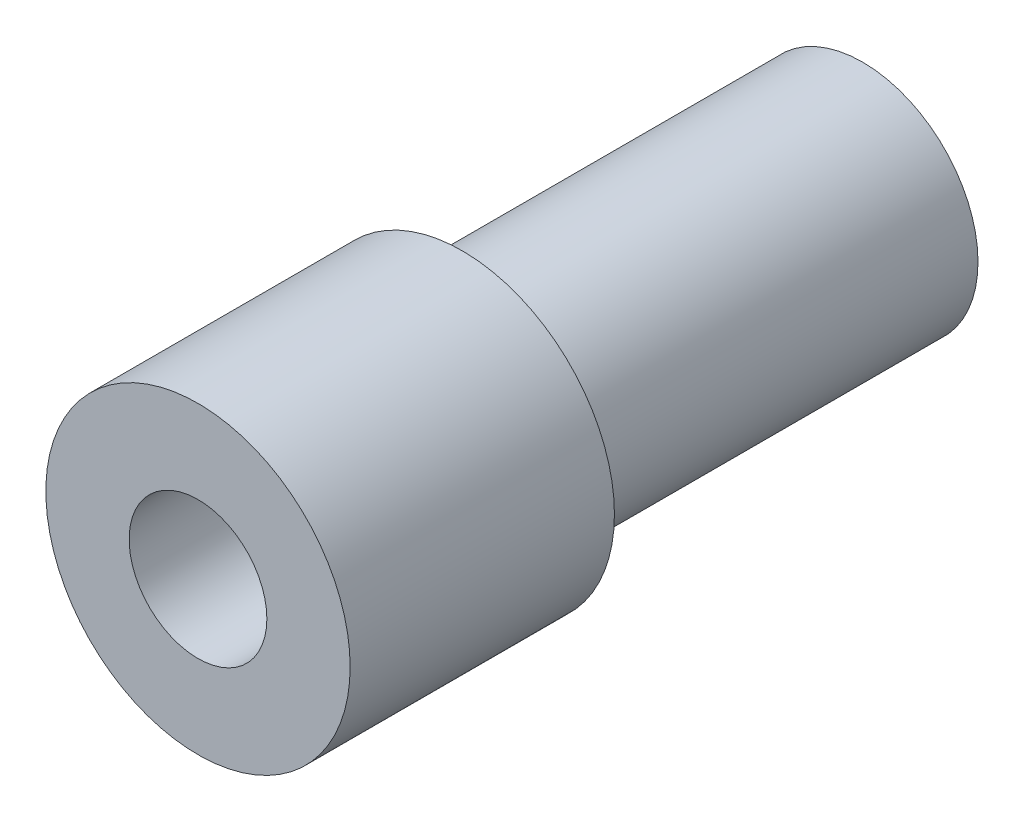
from build123d import *

# Parameters (mm, degrees)
SKETCH_1_R      = 14.4
SKETCH_1_R_2    = 8.6
EXTRUDE_1_DEPTH = 80
EXTRUDE_START   = 3
SKETCH_1_3_R    = 19
SKETCH_1_3_R_2  = 16
SKETCH_1_3_R_3  = 14.4
SKETCH_1_3_R_4  = 8.6
EXTRUDE_2_DEPTH = 3
SKETCH_1_5_R    = 19
SKETCH_1_5_R_2  = 16
EXTRUDE_3_DEPTH = 30
EXTRUDE_START_2 = -77
SKETCH_1_6_R    = 8.6
EXTRUDE_4_DEPTH = 3


with BuildPart() as part:
    # Эскиз1 → Бобышка-Вытянуть1 (new body)
    with BuildSketch(Plane.XY):
        Circle(SKETCH_1_R)
        Circle(SKETCH_1_R_2, mode=Mode.SUBTRACT)
    extrude(amount=-EXTRUDE_1_DEPTH)

    # Эскиз1<3> → Бобышка-Вытянуть2 (add)
    # profile 1 of 3: a face of its own
    with BuildSketch(Plane.XY.offset(EXTRUDE_START)):
        Circle(SKETCH_1_3_R)
        Circle(SKETCH_1_3_R_2, mode=Mode.SUBTRACT)
    # profile 2 of 3: a face of its own
    with BuildSketch(Plane.XY.offset(EXTRUDE_START)):
        Circle(SKETCH_1_3_R_2)
        Circle(SKETCH_1_3_R_3, mode=Mode.SUBTRACT)
    # profile 3 of 3: a face of its own
    with BuildSketch(Plane.XY.offset(EXTRUDE_START)):
        Circle(SKETCH_1_3_R_3)
        Circle(SKETCH_1_3_R_4, mode=Mode.SUBTRACT)
    extrude(amount=-EXTRUDE_2_DEPTH)

    # Эскиз1<5> → Бобышка-Вытянуть3 (add)
    with BuildSketch(Plane.XY):
        Circle(SKETCH_1_5_R)
        Circle(SKETCH_1_5_R_2, mode=Mode.SUBTRACT)
    extrude(amount=-EXTRUDE_3_DEPTH)

    # Эскиз1<6> → Бобышка-Вытянуть4 (add)
    with BuildSketch(Plane.XY.offset(EXTRUDE_START_2)):
        Circle(SKETCH_1_6_R)
    extrude(amount=-EXTRUDE_4_DEPTH)


solid = part.part
